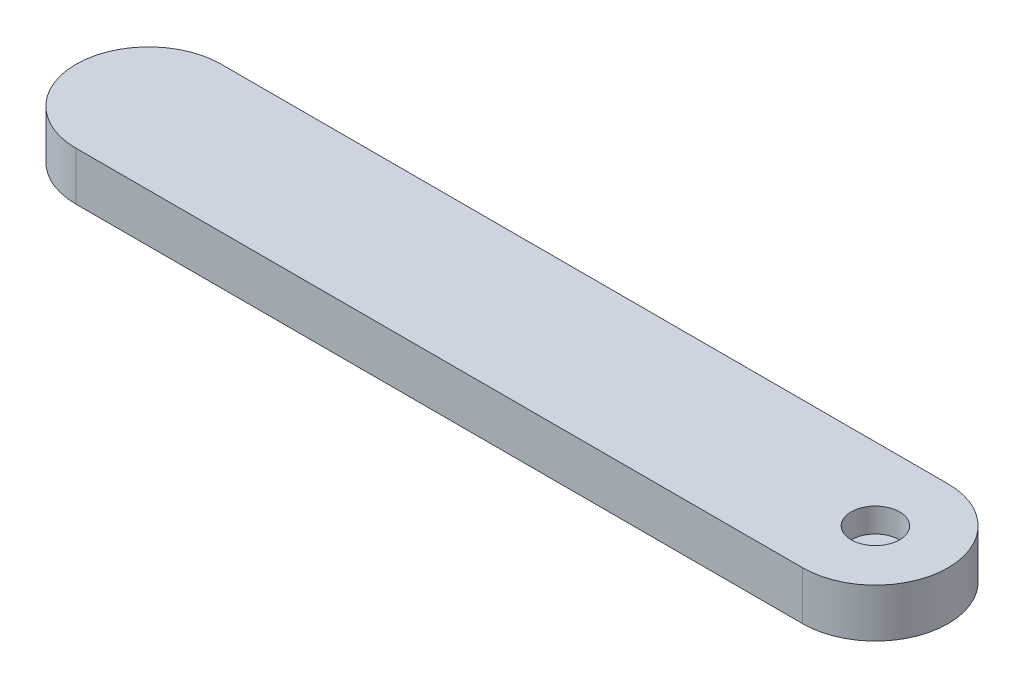
from build123d import *

# Parameters (mm, degrees)
BOSS_EXTRUDE1_DEPTH = 100
SKETCH3_R           = 50
BOSS_EXTRUDE3_DEPTH = 100
SKETCH2_R           = 50
CUT_EXTRUDE1_DEPTH  = 50


with BuildPart() as part:
    # Sketch1 → Boss-Extrude1 (new body)
    with BuildSketch(Plane(origin=(0, 0, 0), x_dir=(1, 0, 0), z_dir=(0, 1, 0))):
        with BuildLine():
            Line((0, 150), (1500, 150))
            ThreePointArc((1500, 150), (1650, 0), (1500, -150))
            Line((1500, -150), (0, -150))
            ThreePointArc((0, -150), (-150, 0), (0, 150))
        make_face()
    extrude(amount=BOSS_EXTRUDE1_DEPTH)

    # Sketch3 → Boss-Extrude3 (add)
    with BuildSketch(Plane.XZ):
        with Locations(Location((0, 0, 0), (0, 0, 90))):
            Circle(SKETCH3_R)
    extrude(amount=BOSS_EXTRUDE3_DEPTH)

    # Sketch2 → Cut-Extrude1 (cut)
    with BuildSketch(Plane(origin=(0, 100, 0), x_dir=(1, 0, 0), z_dir=(0, 1, 0))):
        with Locations(Location((1500, 0, 0), (0, 0, 270))):
            Circle(SKETCH2_R)
    extrude(amount=-CUT_EXTRUDE1_DEPTH, mode=Mode.SUBTRACT)


solid = part.part
